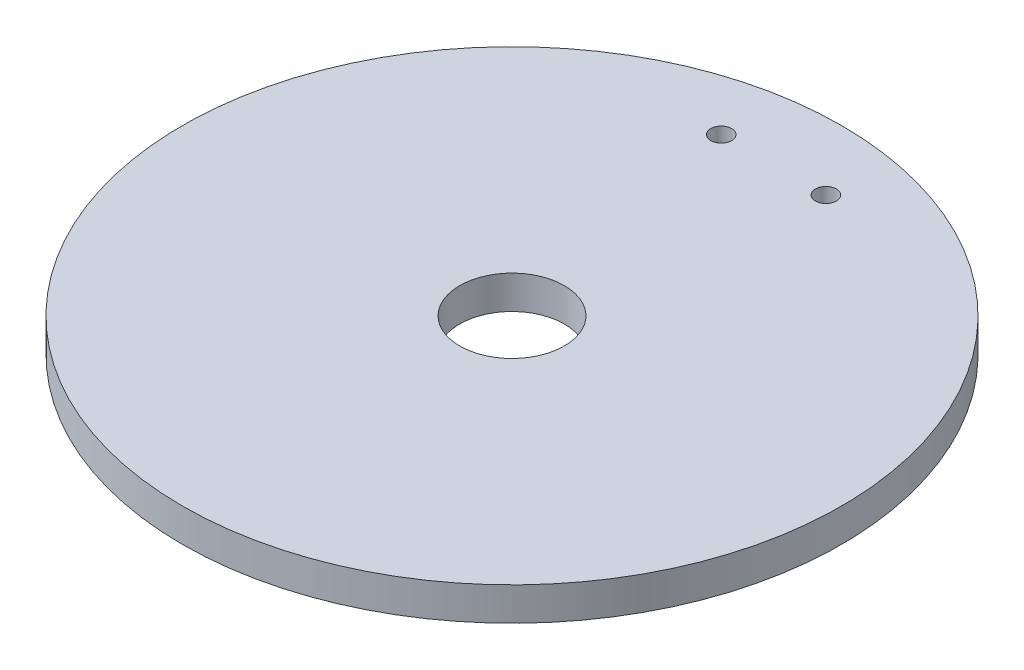
from build123d import *

# Parameters (mm, degrees)
SKETCH1_R           = 31.5
SKETCH1_R_2         = 5
BOSS_EXTRUDE1_DEPTH = 3.18
SKETCH3_R           = 1
CUT_EXTRUDE2_DEPTH  = 45.661083731


with BuildPart() as part:
    # Sketch1 → Boss-Extrude1 (new body)
    with BuildSketch(Plane(origin=(0, 0, 0), x_dir=(1, 0, 0), z_dir=(0, 1, 0))):
        with Locations(Location((0, 0, 0), (0, 0, 90))):
            Circle(SKETCH1_R)
        with Locations(Location((0, 0, 0), (0, 0, 90))):
            Circle(SKETCH1_R_2, mode=Mode.SUBTRACT)
    extrude(amount=BOSS_EXTRUDE1_DEPTH)

    # Sketch3 → Cut-Extrude2 (cut, through all)
    with BuildSketch(Plane(origin=(0, 3.18, 0), x_dir=(1, 0, 0), z_dir=(0, 1, 0))):
        with Locations(Location((-5, 25, 0), (0, 0, 270))):
            Circle(SKETCH3_R)
        with Locations(Location((5, 25, 0), (0, 0, 270))):
            Circle(SKETCH3_R)
    extrude(amount=-CUT_EXTRUDE2_DEPTH, mode=Mode.SUBTRACT)


solid = part.part
